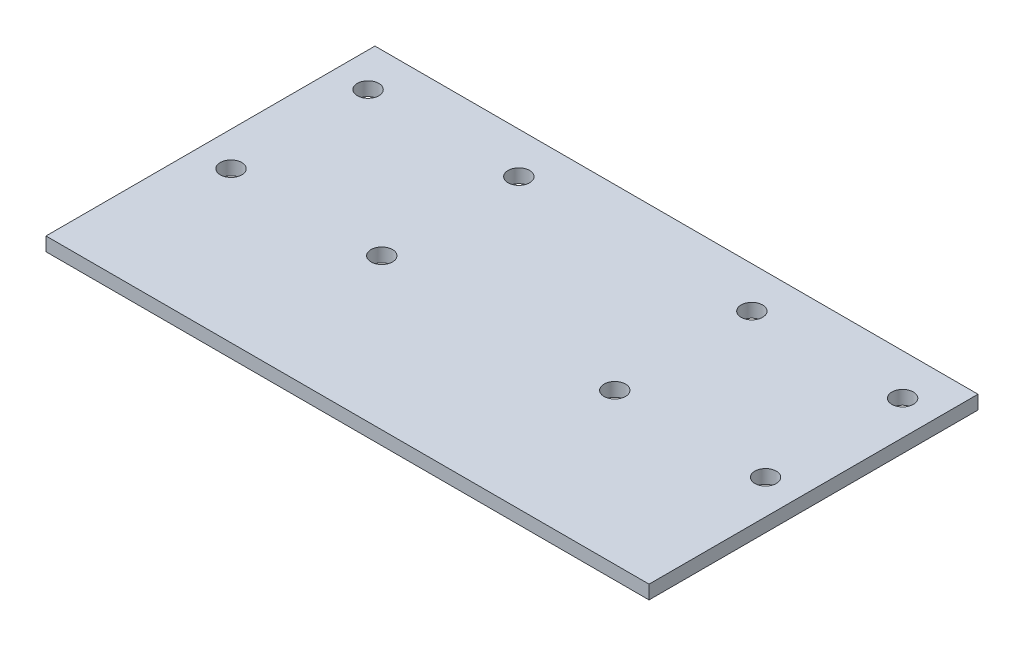
from build123d import *

# Parameters (mm, degrees)
SKETCH1_W                  = 139.7
SKETCH1_H                  = 76.2
BOSS_EXTRUDE1_DEPTH        = 3.175
F_10_CLEARANCE_HOLE1_D     = 4.9784
F_10_CLEARANCE_HOLE1_DEPTH = 6.35
F_10_CLEARANCE_HOLE1_TIP   = 1.495662253


with BuildPart() as part:
    # Sketch1 → Boss-Extrude1 (new body)
    with BuildSketch(Plane(origin=(0, 0, 0), x_dir=(1, 0, 0), z_dir=(0, 1, 0))):
        Rectangle(SKETCH1_W, SKETCH1_H)
    extrude(amount=BOSS_EXTRUDE1_DEPTH)

    # #10 Clearance Hole1
    with Locations(Plane(origin=(0, 3.175, 0), x_dir=(1, 0, 0), z_dir=(0, 1, 0))):
        with Locations((-61.9125, 28.575), (-61.9125, -3.175), (-26.9875, -3.175), (-26.9875, 28.575), (26.9875, 28.575), (61.9125, 28.575), (61.9125, -3.175), (26.9875, -3.175)):
            Hole(F_10_CLEARANCE_HOLE1_D / 2, depth=F_10_CLEARANCE_HOLE1_DEPTH)
            with Locations((0, 0, -(F_10_CLEARANCE_HOLE1_DEPTH + F_10_CLEARANCE_HOLE1_TIP / 2))):  # 118° drill point
                Cone(0, F_10_CLEARANCE_HOLE1_D / 2, F_10_CLEARANCE_HOLE1_TIP, mode=Mode.SUBTRACT)


solid = part.part
